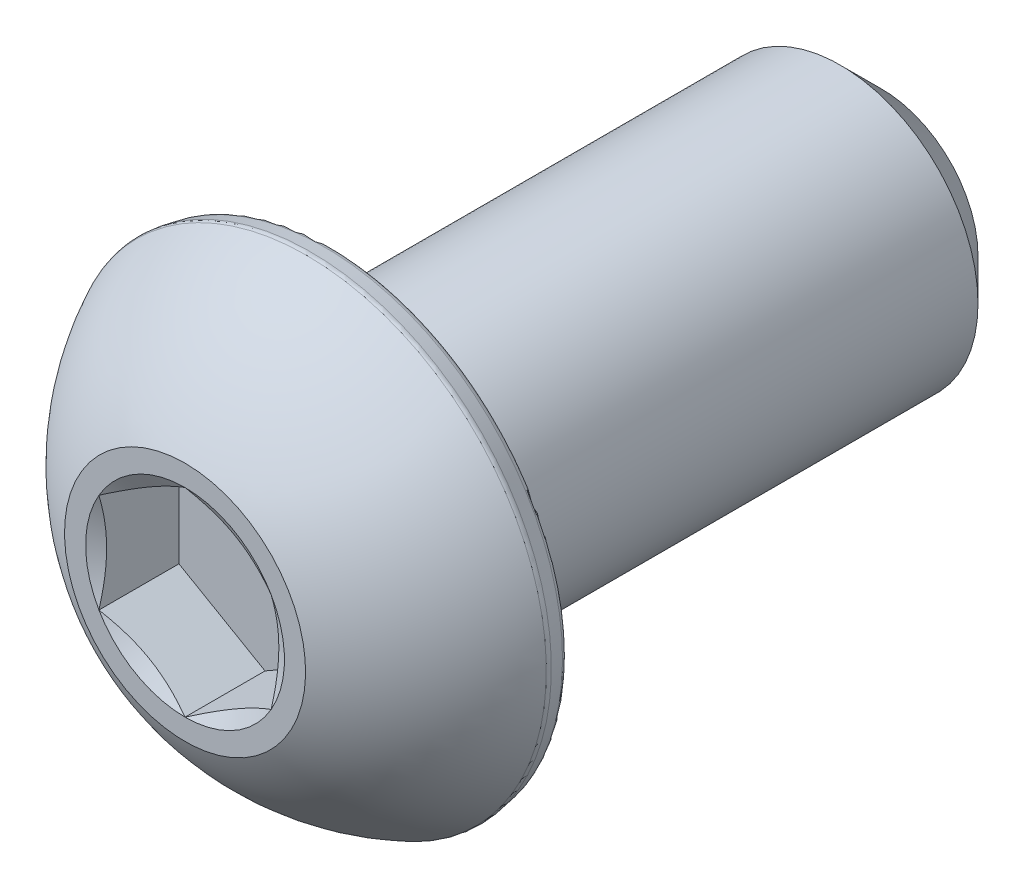
from build123d import *

# Parameters (mm, degrees)
CUT_EXTRUDE1_DEPTH = 1.84404
FILLET1_R          = 0.16764


with BuildPart() as part:
    # Sketch3 → Revolve1 (revolve)
    with BuildSketch(Plane(origin=(0, 0, 0), x_dir=(0, 0, -1), z_dir=(1, 0, 0)), mode=Mode.PRIVATE) as revolve1_sk:
        with BuildLine():
            Line((-8.0264, 0), (-8.0264, 2.778125))
            ThreePointArc((-8.0264, 2.778125), (-6.832024687, 4.401074199), (-5.17652, 5.5499))
            Line((-5.17652, 5.5499), (-4.6736, 5.461221635))
            Line((-4.6736, 5.461221635), (-4.6736, 3.175))
            Line((-4.6736, 3.175), (7.0739, 3.175))
            Line((7.0739, 3.175), (8.0264, 2.2225))
            Line((8.0264, 2.2225), (8.0264, 0))
            Line((8.0264, 0), (-8.0264, 0))
        make_face()
    revolve(revolve1_sk.sketch.rotate(Axis((0, 0, 8.0264), (0, 0, -1)), 90), axis=Axis((0, 0, 8.0264), (0, 0, -1)))

    # Sketch4 → Cut-Extrude1 (cut)
    with BuildSketch(Plane.XY.offset(8.0264)):
        Polygon((-1.984375, -1.14567944), (0, -2.291358881), (1.984375, -1.14567944), (1.984375, 1.14567944), (0, 2.291358881), (-1.984375, 1.14567944), align=None)
    extrude(amount=-CUT_EXTRUDE1_DEPTH, mode=Mode.SUBTRACT)

    # Cut-Extrude2 cone 1 section (through the dimple's axis) → Cut-Extrude2 (revolve, cut)
    with BuildSketch(Plane(origin=(0, 0, 8.0264), x_dir=(0, -1, 0), z_dir=(1, 0, 0))):
        Polygon((0, 0), (2.291358881, 0), (0, 1.322916667), align=None)
    revolve(axis=Axis((0, 0, 8.0264), (0, 0, -1)), mode=Mode.SUBTRACT)

    # Fillet1
    fillet1_edges = [part.edges().sort_by_distance(p)[0] for p in [
        (-5.461221635, 0, 4.6736),
        (-5.5499, 0, 5.17652),
    ]]
    fillet(fillet1_edges, radius=FILLET1_R)


solid = part.part
